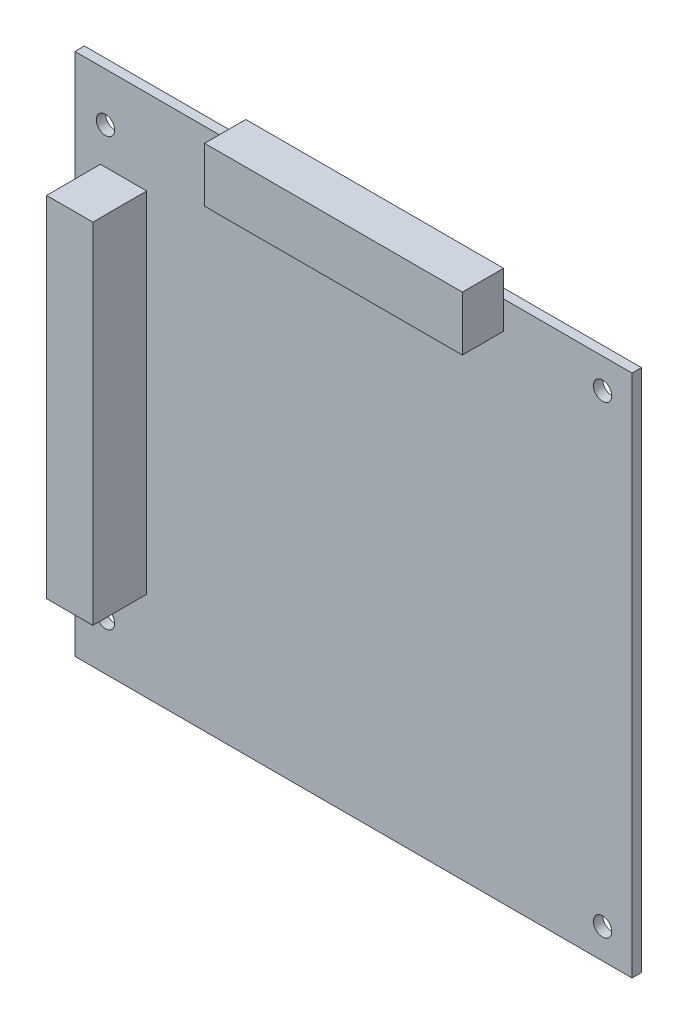
from build123d import *

# Parameters (mm, degrees)
SKETCH1_W                    = 96.0628
SKETCH1_H                    = 90.3478
PCB_DEPTH                    = 1.6256
SKETCH5_R                    = 1.5875
PCB_HOLES_DEPTH              = 66.957101229
PCI_104_CONNECTOR_DEPTH      = 9.2964
PCI_104_CONNECTOR_DEPTH_BACK = 12.6238
SKETCH2_W                    = 7.9756
SKETCH2_H                    = 60.2234
SKETCH6_W                    = 44.45
SKETCH6_H                    = 9.398
PCB_EDGE_CONNS_DEPTH         = 7.112


with BuildPart() as part:
    # Sketch1 → PCB (new body)
    with BuildSketch(Plane.XY):
        Rectangle(SKETCH1_W, SKETCH1_H)
    extrude(amount=PCB_DEPTH)

    # Sketch5 → PCB_Holes (cut, through all)
    with BuildSketch(Plane.XY.offset(1.6256)):
        with Locations((-42.7736, 36.83)):
            Circle(SKETCH5_R)
        with Locations((42.9514, 40.005)):
            Circle(SKETCH5_R)
        with Locations((42.9514, -40.005)):
            Circle(SKETCH5_R)
        with Locations((-42.7736, -36.83)):
            Circle(SKETCH5_R)
    extrude(amount=-PCB_HOLES_DEPTH, mode=Mode.SUBTRACT)

    # Sketch2 → PCI-104_Connector (add, two sides: drawn at the far end of the back side and taken through both)
    with BuildSketch(Plane.XY.offset(1.6256).offset(-PCI_104_CONNECTOR_DEPTH_BACK)):
        with Locations((-39.6494, 0.4064)):
            Rectangle(SKETCH2_W, SKETCH2_H)
    extrude(amount=PCI_104_CONNECTOR_DEPTH + PCI_104_CONNECTOR_DEPTH_BACK)

    # Sketch6 → PCB_Edge_Conns (add)
    with BuildSketch(Plane.XY.offset(1.6256)):
        with Locations((3.6576, 45.0469)):
            Rectangle(SKETCH6_W, SKETCH6_H)
    extrude(amount=PCB_EDGE_CONNS_DEPTH)


solid = part.part
